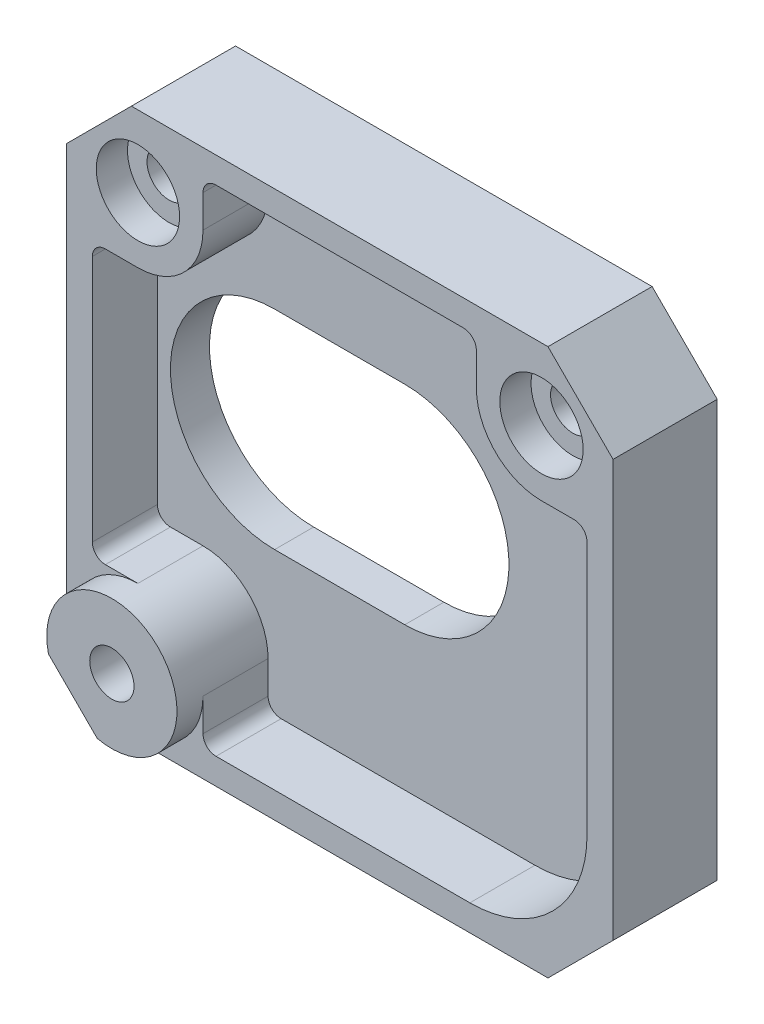
from build123d import *

# Parameters (mm, degrees)
SKETCH_1_W          = 42
SKETCH_1_H          = 42
SKETCH_1_R          = 1.7
EXTRUDE_1_DEPTH     = 8
CHAMFER_1_SIZE      = 5
CUT_EXTRUDE_1_DEPTH = 5
SKETCH_3_R          = 1.7
EXTRUDE_2_DEPTH     = 2
SKETCH_4_R          = 3.2
CUT_EXTRUDE_2_DEPTH = 2.4
SKETCH_5_R          = 3.4
CUT_EXTRUDE_3_DEPTH = 2.4
FILLET_1_R          = 1


with BuildPart() as part:
    # Эскиз1 → Бобышка-Вытянуть1 (new body)
    with BuildSketch(Plane.XY):
        Rectangle(SKETCH_1_W, SKETCH_1_H)
        with Locations((-15.5, -15.5)):
            Circle(SKETCH_1_R, mode=Mode.SUBTRACT)
        with Locations((-15.5, 15.5)):
            Circle(SKETCH_1_R, mode=Mode.SUBTRACT)
        with Locations((15.5, 15.5)):
            Circle(SKETCH_1_R, mode=Mode.SUBTRACT)
        with BuildLine():
            Line((0, -8), (-10, -8))
            ThreePointArc((-10, -8), (-18, 0), (-10, 8))
            Line((-10, 8), (0, 8))
            ThreePointArc((0, 8), (8, 0), (0, -8))
        make_face(mode=Mode.SUBTRACT)
    extrude(amount=EXTRUDE_1_DEPTH)

    # Фаска1
    chamfer_1_edges = [part.edges().sort_by_distance(p)[0] for p in [
        (-21, 21, 4),
        (21, 21, 4),
        (21, -21, 4),
        (-21, -21, 4),
    ]]
    chamfer(chamfer_1_edges, length=CHAMFER_1_SIZE)

    # Эскиз2 → Вырез-Вытянуть1 (cut)
    with BuildSketch(Plane.XY.offset(8)):
        with BuildLine():
            Line((-10.5, 15.5), (-10.5, 19))
            Line((-10.5, 19), (10.5, 19))
            Line((10.5, 19), (10.5, 15.5))
            ThreePointArc((10.5, 15.5), (11.964466094, 11.964466094), (15.5, 10.5))
            Line((15.5, 10.5), (19, 10.5))
            Line((19, 10.5), (19, -10))
            ThreePointArc((19, -10), (16.363961031, -16.363961031), (10, -19))
            Line((10, -19), (-10.5, -19))
            Line((-10.5, -19), (-10.5, -15.5))
            ThreePointArc((-10.5, -15.5), (-11.964466094, -11.964466094), (-15.5, -10.5))
            Line((-15.5, -10.5), (-19, -10.5))
            Line((-19, -10.5), (-19, 10.5))
            Line((-19, 10.5), (-15.5, 10.5))
            ThreePointArc((-15.5, 10.5), (-11.964466094, 11.964466094), (-10.5, 15.5))
        make_face()
    extrude(amount=-CUT_EXTRUDE_1_DEPTH, mode=Mode.SUBTRACT)

    # Эскиз3 → Бобышка-Вытянуть2 (add)
    with BuildSketch(Plane.XY.offset(8)):
        with BuildLine():
            Line((-20.370828693, -16.629171307), (-16.629171307, -20.370828693))
            ThreePointArc((-16.629171307, -20.370828693), (-11.964466094, -11.964466094), (-20.370828693, -16.629171307))
        make_face()
        with Locations((-15.5, -15.5)):
            Circle(SKETCH_3_R, mode=Mode.SUBTRACT)
    extrude(amount=EXTRUDE_2_DEPTH)

    # Эскиз4 → Вырез-Вытянуть2 (cut)
    with BuildSketch(Plane.XY.offset(8)):
        with Locations((-15.5, 15.5)):
            Circle(SKETCH_4_R)
        with Locations((15.5, 15.5)):
            Circle(SKETCH_4_R)
    extrude(amount=-CUT_EXTRUDE_2_DEPTH, mode=Mode.SUBTRACT)

    # Эскиз5 → Вырез-Вытянуть3 (cut)
    with BuildSketch(Plane(origin=(0, 0, 0), x_dir=(-1, 0, 0), z_dir=(0, 0, -1))):
        with Locations((-15.5, 15.5)):
            Circle(SKETCH_5_R)
        with Locations((15.5, 15.5)):
            Circle(SKETCH_5_R)
        with Locations((15.5, -15.5)):
            Circle(SKETCH_5_R)
    extrude(amount=-CUT_EXTRUDE_3_DEPTH, mode=Mode.SUBTRACT)

    # Скругление1
    fillet_1_edges = [part.edges().sort_by_distance(p)[0] for p in [
        (-10.5, 19, 5.5),
        (10.5, 19, 5.5),
        (19, 10.5, 5.5),
        (-10.5, -19, 5.5),
        (-19, -10.5, 5.5),
        (-19, 10.5, 5.5),
    ]]
    fillet(fillet_1_edges, radius=FILLET_1_R)


solid = part.part
